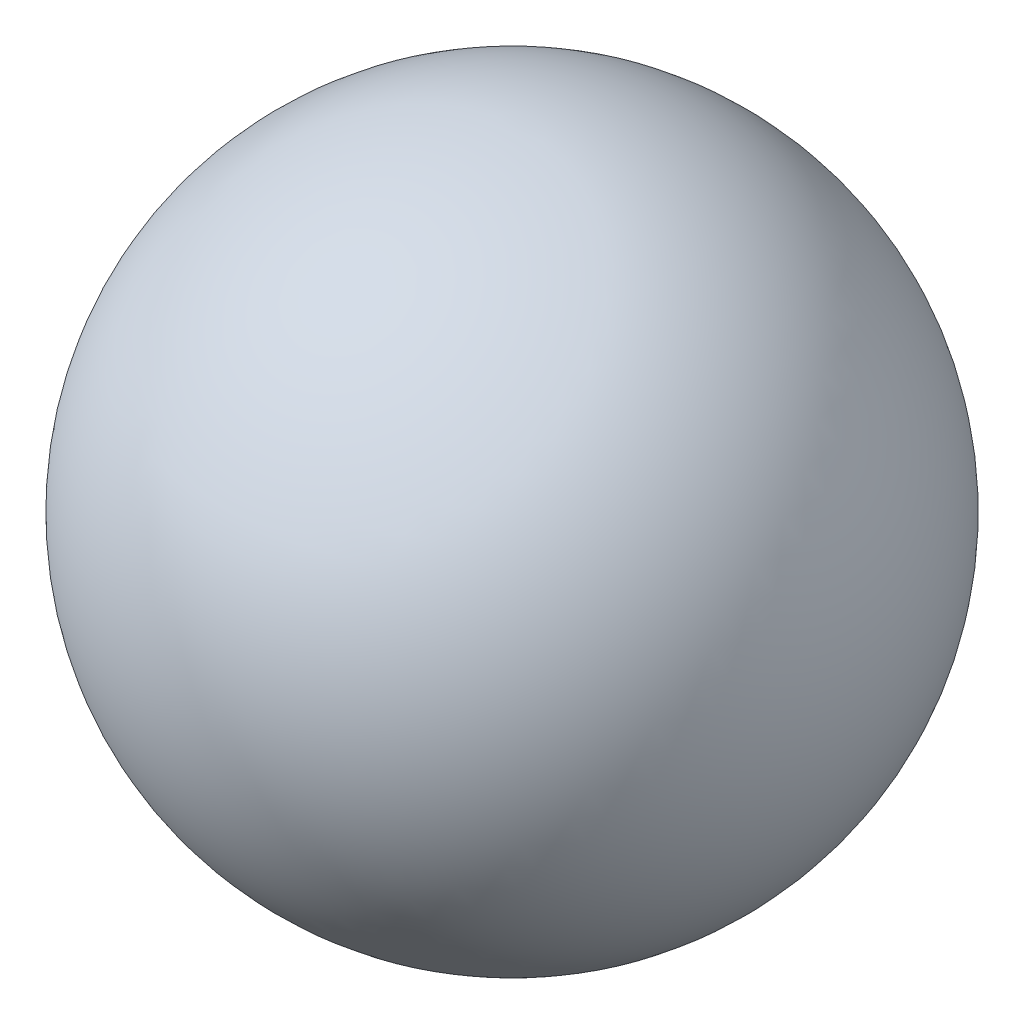
from build123d import *


with BuildPart() as part:
    # Sketch1 → Revolve1 (revolve)
    with BuildSketch(Plane.XY):
        with BuildLine():
            Line((0, 33.5), (0, 28.75))
            ThreePointArc((0, 28.75), (-28.75, 0), (0, -28.75))
            Line((0, -28.75), (0, -33.5))
            ThreePointArc((0, -33.5), (-33.5, 0), (0, 33.5))
        make_face()
    revolve(axis=Axis((0, 105.084210526, 0), (0, -1, 0)))


solid = part.part
